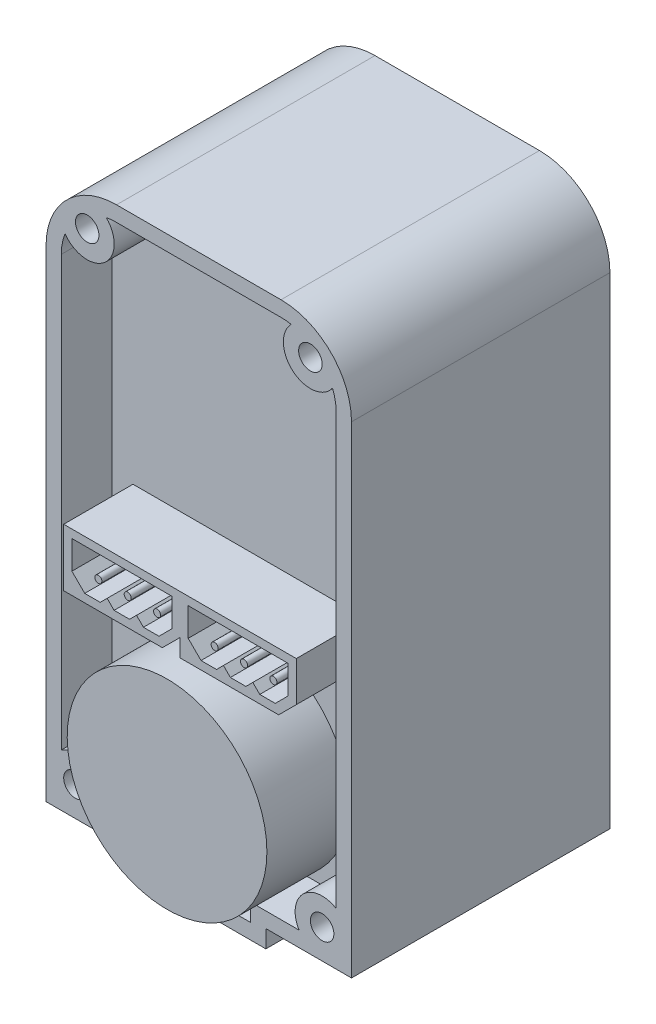
from build123d import *

# Parameters (mm, degrees)
BOSS_EXTRUDE1_DEPTH = 11
SKETCH2_R           = 1
CUT_EXTRUDE1_DEPTH  = 37.813720268
CUT_EXTRUDE2_DEPTH  = 4.3
SKETCH6_R           = 8.5
BOSS_EXTRUDE2_DEPTH = 7
BOSS_EXTRUDE3_DEPTH = 5.9
CUT_EXTRUDE3_DEPTH  = 4
SKETCH9_R           = 0.3
BOSS_EXTRUDE4_DEPTH = 3.5
CUT_EXTRUDE4_START  = -6.34
CUT_EXTRUDE4_DEPTH  = 6.34
CUT_EXTRUDE5_START  = -6.96
CUT_EXTRUDE5_DEPTH  = 6.96
SKETCH14_R          = 0.8
CUT_EXTRUDE6_DEPTH  = 2
SKETCH15_R          = 1
CUT_EXTRUDE7_DEPTH  = 2
SKETCH16_R          = 3.575
CUT_EXTRUDE8_DEPTH  = 3
CUT_EXTRUDE9_START  = -0.7
CUT_EXTRUDE9_DEPTH  = 0.7
BOSS_EXTRUDE5_DEPTH = 2
SKETCH19_R          = 0.75
BOSS_EXTRUDE6_DEPTH = 5
BOSS_EXTRUDE7_DEPTH = 2.7
SKETCH21_R          = 0.8
CUT_EXTRUDE10_DEPTH = 1
BOSS_EXTRUDE8_START = 3
SKETCH22_R          = 5.6
SKETCH22_R_2        = 3.575
BOSS_EXTRUDE8_DEPTH = 3


with BuildPart() as part:
    # Sketch1 → Boss-Extrude1 (new, symmetric)
    with BuildSketch(Plane.XY):
        with BuildLine():
            Line((-7, 26.5), (7, 26.5))
            ThreePointArc((7, 26.5), (11.242640687, 24.742640687), (13, 20.5))
            Line((13, 20.5), (13, -20.5))
            Line((13, -20.5), (5.71, -20.5))
            Line((5.71, -20.5), (5.71, -22))
            Line((5.71, -22), (-5.71, -22))
            Line((-5.71, -22), (-5.71, -20.5))
            Line((-5.71, -20.5), (-13, -20.5))
            Line((-13, -20.5), (-13, 20.5))
            ThreePointArc((-13, 20.5), (-11.242640687, 24.742640687), (-7, 26.5))
        make_face()
    extrude(amount=BOSS_EXTRUDE1_DEPTH, both=True)

    # Sketch2 → Cut-Extrude1 (cut, through all)
    with BuildSketch(Plane.XY.offset(11)):
        with Locations((-9.5, 23.5)):
            Circle(SKETCH2_R)
        with Locations((-10.5, -18)):
            Circle(SKETCH2_R)
        with Locations((10.5, -18)):
            Circle(SKETCH2_R)
        with Locations((9.5, 23.5)):
            Circle(SKETCH2_R)
    extrude(amount=-CUT_EXTRUDE1_DEPTH, mode=Mode.SUBTRACT)

    # Sketch4 → Cut-Extrude2 (cut)
    with BuildSketch(Plane.XY.offset(11)):
        with BuildLine():
            Line((4.41, -19.2), (8.537858313, -19.2))
            ThreePointArc((8.537858313, -19.2), (8.873654403, -16.373654403), (11.7, -16.037858313))
            Line((11.7, -16.037858313), (11.7, 20.5))
            ThreePointArc((11.7, 20.5), (11.621181185, 21.357137361), (11.387368317, 22.185526403))
            ThreePointArc((11.387368317, 22.185526403), (8.027575881, 21.733091057), (7.866730044, 25.11939163))
            ThreePointArc((7.866730044, 25.11939163), (7.435235189, 25.179804518), (7, 25.2))
            Line((7, 25.2), (-7, 25.2))
            ThreePointArc((-7, 25.2), (-7.435235189, 25.179804518), (-7.866730044, 25.11939163))
            ThreePointArc((-7.866730044, 25.11939163), (-8.027575881, 21.733091057), (-11.387368317, 22.185526403))
            ThreePointArc((-11.387368317, 22.185526403), (-11.621181185, 21.357137361), (-11.7, 20.5))
            Line((-11.7, 20.5), (-11.7, -16.037858313))
            ThreePointArc((-11.7, -16.037858313), (-8.873654403, -16.373654403), (-8.537858313, -19.2))
            Line((-8.537858313, -19.2), (-4.41, -19.2))
            Line((-4.41, -19.2), (-4.41, -20.7))
            Line((-4.41, -20.7), (4.41, -20.7))
            Line((4.41, -20.7), (4.41, -19.2))
        make_face()
    extrude(amount=-CUT_EXTRUDE2_DEPTH, mode=Mode.SUBTRACT)

    # Sketch6 → Boss-Extrude2 (add)
    with BuildSketch(Plane.XY.offset(6.7)):
        with Locations(Location((0, -12.1, 0), (0, 0, 236.646476163))):
            Circle(SKETCH6_R)
    extrude(amount=BOSS_EXTRUDE2_DEPTH)

    # Sketch7 → Boss-Extrude3 (add)
    with BuildSketch(Plane.XY.offset(6.7)):
        Polygon((-1.5, -2.6), (0, -1.1), (0, -2.6), (8.4, -2.6), (9.9, -1.1), (9.9, 2.3), (-9.9, 2.3), (-9.9, -2.6), align=None)
    extrude(amount=BOSS_EXTRUDE3_DEPTH)

    # Sketch8 → Cut-Extrude3 (cut)
    with BuildSketch(Plane.XY.offset(12.6)):
        Polygon((-9.2, 1.6), (-9.2, -0.810050506), (-8.110050506, -1.9), (-6.789949494, -1.9), (-6.2, -1.310050506), (-5.610050506, -1.9), (-4.289949494, -1.9), (-3.7, -1.310050506), (-3.110050506, -1.9), (-1.789949494, -1.9), (-0.7, -0.810050506), (-0.7, 1.6), align=None)
        Polygon((5.610050506, -1.9), (4.289949494, -1.9), (3.7, -1.310050506), (3.110050506, -1.9), (1.789949494, -1.9), (0.7, -0.810050506), (0.7, 1.6), (9.2, 1.6), (9.2, -0.810050506), (8.110050506, -1.9), (6.789949494, -1.9), (6.2, -1.310050506), align=None)
    extrude(amount=-CUT_EXTRUDE3_DEPTH, mode=Mode.SUBTRACT)

    # Sketch9 → Boss-Extrude4 (add)
    with BuildSketch(Plane.XY.offset(8.6)):
        with Locations((-7.45, -0.78)):
            Circle(SKETCH9_R)
        with Locations((-4.95, -0.78)):
            Circle(SKETCH9_R)
        with Locations((-2.45, -0.78)):
            Circle(SKETCH9_R)
        with Locations(Location((2.45, -0.78, 0), (0, 0, 180))):
            Circle(SKETCH9_R)
        with Locations(Location((4.95, -0.78, 0), (0, 0, 180))):
            Circle(SKETCH9_R)
        with Locations(Location((7.45, -0.78, 0), (0, 0, 180))):
            Circle(SKETCH9_R)
    extrude(amount=BOSS_EXTRUDE4_DEPTH)

    # Sketch11 → Cut-Extrude4 (cut)
    with BuildSketch(Plane(origin=(0, 0, -11), x_dir=(-1, 0, 0), z_dir=(0, 0, -1)).offset(CUT_EXTRUDE4_START)):
        with BuildLine():
            Line((3.3, -3), (11.7, -3))
            Line((11.7, -3), (11.7, 20.5))
            ThreePointArc((11.7, 20.5), (11.621181185, 21.357137361), (11.387368317, 22.185526403))
            ThreePointArc((11.387368317, 22.185526403), (8.027575881, 21.733091057), (7.866730044, 25.11939163))
            ThreePointArc((7.866730044, 25.11939163), (7.435235189, 25.179804518), (7, 25.2))
            Line((7, 25.2), (-7, 25.2))
            ThreePointArc((-7, 25.2), (-7.435235189, 25.179804518), (-7.866730044, 25.11939163))
            ThreePointArc((-7.866730044, 25.11939163), (-8.027575881, 21.733091057), (-11.387368317, 22.185526403))
            ThreePointArc((-11.387368317, 22.185526403), (-11.621181185, 21.357137361), (-11.7, 20.5))
            Line((-11.7, 20.5), (-11.7, -5))
            Line((-11.7, -5), (-5, -5))
            ThreePointArc((-5, -5), (-1.958040085, -4.304480936), (0.479422369, -2.356137108))
            ThreePointArc((0.479422369, -2.356137108), (1.853433583, -2.836990264), (3.3, -3))
        make_face()
    extrude(amount=CUT_EXTRUDE4_DEPTH, mode=Mode.SUBTRACT)

    # Sketch12 → Cut-Extrude5 (cut)
    with BuildSketch(Plane(origin=(0, 0, -4.66), x_dir=(-1, 0, 0), z_dir=(0, 0, -1)).offset(CUT_EXTRUDE5_START)):
        with BuildLine():
            Line((7, 25.2), (-7, 25.2))
            ThreePointArc((-7, 25.2), (-7.435235189, 25.179804518), (-7.866730044, 25.11939163))
            ThreePointArc((-7.866730044, 25.11939163), (-8.027575881, 21.733091057), (-11.387368317, 22.185526403))
            ThreePointArc((-11.387368317, 22.185526403), (-11.621181185, 21.357137361), (-11.7, 20.5))
            Line((-11.7, 20.5), (-11.7, 15))
            ThreePointArc((-11.7, 15), (-9.334774926, 7.94649186), (-3.195388533, 3.744801551))
            ThreePointArc((-3.195388533, 3.744801551), (-1.381944579, -1.008813032), (3.3, -3))
            Line((3.3, -3), (11.7, -3))
            Line((11.7, -3), (11.7, 20.5))
            ThreePointArc((11.7, 20.5), (11.621181185, 21.357137361), (11.387368317, 22.185526403))
            ThreePointArc((11.387368317, 22.185526403), (8.027575881, 21.733091057), (7.866730044, 25.11939163))
            ThreePointArc((7.866730044, 25.11939163), (7.435235189, 25.179804518), (7, 25.2))
        make_face()
    extrude(amount=CUT_EXTRUDE5_DEPTH, mode=Mode.SUBTRACT)

    # Sketch14 → Cut-Extrude6 (cut)
    with BuildSketch(Plane(origin=(0, 0, -4.66), x_dir=(-1, 0, 0), z_dir=(0, 0, -1))):
        with Locations((-5, 2)):
            Circle(SKETCH14_R)
    extrude(amount=-CUT_EXTRUDE6_DEPTH, mode=Mode.SUBTRACT)

    # Sketch15 → Cut-Extrude7 (cut)
    with BuildSketch(Plane(origin=(0, 0, 2.3), x_dir=(-1, 0, 0), z_dir=(0, 0, -1))):
        with Locations((3.3, 3.5)):
            Circle(SKETCH15_R)
    extrude(amount=-CUT_EXTRUDE7_DEPTH, mode=Mode.SUBTRACT)

    # Sketch16 → Cut-Extrude8 (cut)
    with BuildSketch(Plane(origin=(0, 0, 2.3), x_dir=(-1, 0, 0), z_dir=(0, 0, -1))):
        with Locations((0, 15)):
            Circle(SKETCH16_R)
    extrude(amount=-CUT_EXTRUDE8_DEPTH, mode=Mode.SUBTRACT)

    # Sketch17 → Cut-Extrude9 (cut)
    with BuildSketch(Plane(origin=(0, 0, -11), x_dir=(-1, 0, 0), z_dir=(0, 0, -1)).offset(CUT_EXTRUDE9_START)):
        with BuildLine():
            Line((4.41, -20.7), (4.41, -19.2))
            Line((4.41, -19.2), (8.537858313, -19.2))
            ThreePointArc((8.537858313, -19.2), (8.873654403, -16.373654403), (11.7, -16.037858313))
            Line((11.7, -16.037858313), (11.7, 20.5))
            ThreePointArc((11.7, 20.5), (11.621181185, 21.357137361), (11.387368317, 22.185526403))
            ThreePointArc((11.387368317, 22.185526403), (8.027575881, 21.733091057), (7.866730044, 25.11939163))
            ThreePointArc((7.866730044, 25.11939163), (7.435235189, 25.179804518), (7, 25.2))
            Line((7, 25.2), (-7, 25.2))
            ThreePointArc((-7, 25.2), (-7.435235189, 25.179804518), (-7.866730044, 25.11939163))
            ThreePointArc((-7.866730044, 25.11939163), (-8.027575881, 21.733091057), (-11.387368317, 22.185526403))
            ThreePointArc((-11.387368317, 22.185526403), (-11.621181185, 21.357137361), (-11.7, 20.5))
            Line((-11.7, 20.5), (-11.7, -16.037858313))
            ThreePointArc((-11.7, -16.037858313), (-8.873654403, -16.373654403), (-8.537858313, -19.2))
            Line((-8.537858313, -19.2), (-4.41, -19.2))
            Line((-4.41, -19.2), (-4.41, -20.7))
            Line((-4.41, -20.7), (4.41, -20.7))
        make_face()
    extrude(amount=CUT_EXTRUDE9_DEPTH, mode=Mode.SUBTRACT)

    # Sketch18 → Boss-Extrude5 (add)
    with BuildSketch(Plane(origin=(0, 0, -10.3), x_dir=(-1, 0, 0), z_dir=(0, 0, -1))):
        with BuildLine():
            Line((-4.462062303, -20.6), (4.462062303, -20.6))
            ThreePointArc((4.462062303, -20.6), (9.568945301, -11.328452318), (3.042556406, -2.994899753))
            ThreePointArc((3.042556406, -2.994899753), (1.728199092, -2.807094569), (0.479422369, -2.356137108))
            ThreePointArc((0.479422369, -2.356137108), (-1.958040085, -4.304480936), (-5, -5))
            Line((-5, -5), (-6.461423992, -5))
            ThreePointArc((-6.461423992, -5), (-9.522113117, -13.320394113), (-4.462062303, -20.6))
        make_face()
    extrude(amount=BOSS_EXTRUDE5_DEPTH)

    # Sketch19 → Boss-Extrude6 (add)
    with BuildSketch(Plane(origin=(0, 0, -12.3), x_dir=(-1, 0, 0), z_dir=(0, 0, -1))):
        with Locations((0, -12.1)):
            Circle(SKETCH19_R)
    extrude(amount=BOSS_EXTRUDE6_DEPTH)

    # Sketch20 → Boss-Extrude7 (add)
    with BuildSketch(Plane(origin=(0, 0, -17.3), x_dir=(-1, 0, 0), z_dir=(0, 0, -1))):
        Polygon((-0.352165696, -10.900633783), (0, -10.475), (0.352165696, -10.900633783), (0.878541328, -10.732963009), (0.944686968, -11.281424083), (1.478151992, -11.424950604), (1.237276802, -11.922106452), (1.608459843, -12.331261612), (1.137039994, -12.619268766), (1.228093058, -13.164148693), (0.675801022, -13.151566916), (0.457815405, -13.659176082), (0, -13.35), (-0.457815405, -13.659176082), (-0.675801022, -13.151566916), (-1.228093058, -13.164148693), (-1.137039994, -12.619268766), (-1.608459843, -12.331261612), (-1.237276802, -11.922106452), (-1.478151992, -11.424950604), (-0.944686968, -11.281424083), (-0.878541328, -10.732963009), align=None)
    extrude(amount=-BOSS_EXTRUDE7_DEPTH)

    # Sketch21 → Cut-Extrude10 (cut)
    with BuildSketch(Plane(origin=(0, 0, -12.3), x_dir=(-1, 0, 0), z_dir=(0, 0, -1))):
        with Locations((0.8, -4.7)):
            Circle(SKETCH21_R)
    extrude(amount=-CUT_EXTRUDE10_DEPTH, mode=Mode.SUBTRACT)

    # Sketch22 → Boss-Extrude8 (add)
    with BuildSketch(Plane(origin=(0, 0, 2.3), x_dir=(-1, 0, 0), z_dir=(0, 0, -1)).offset(BOSS_EXTRUDE8_START)):
        with Locations(Location((0, 15, 0), (0, 0, 180))):
            Circle(SKETCH22_R)
        with Locations((0, 15)):
            Circle(SKETCH22_R_2, mode=Mode.SUBTRACT)
    extrude(amount=-BOSS_EXTRUDE8_DEPTH)


solid = part.part
